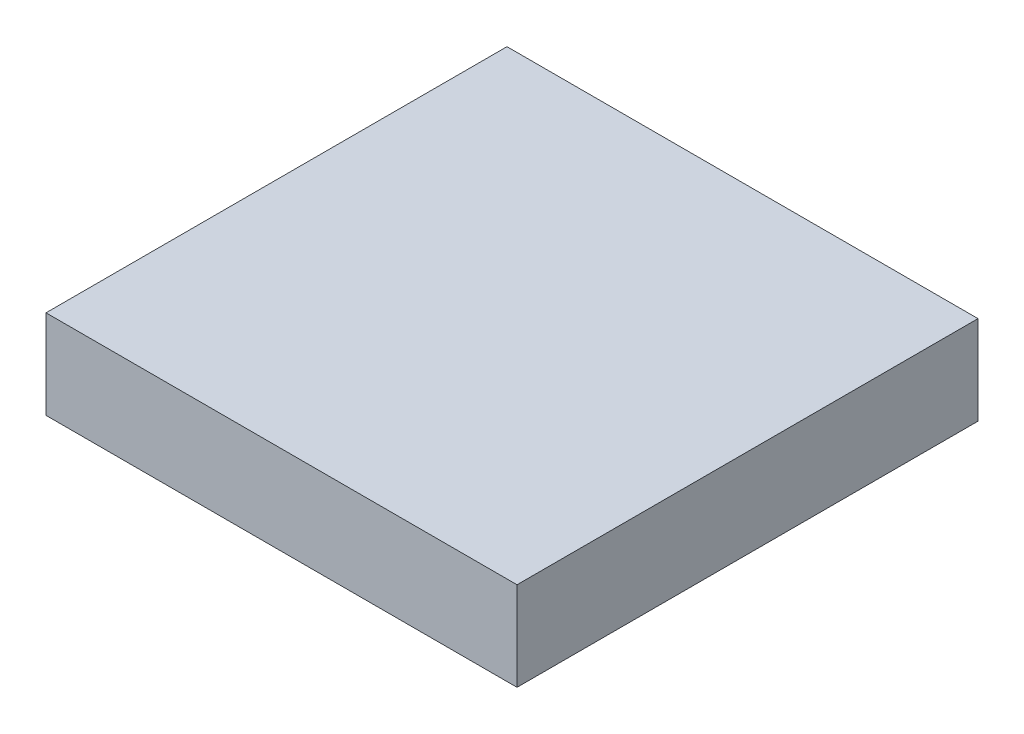
from build123d import *

# Parameters (mm, degrees)
SKETCH1_W           = 182.9
SKETCH1_H           = 179
BOSS_EXTRUDE1_DEPTH = 34.5


with BuildPart() as part:
    # Sketch1 → Boss-Extrude1 (new body)
    with BuildSketch(Plane(origin=(0, 0, 0), x_dir=(1, 0, 0), z_dir=(0, 1, 0))):
        Rectangle(SKETCH1_W, SKETCH1_H)
    extrude(amount=BOSS_EXTRUDE1_DEPTH)


solid = part.part
